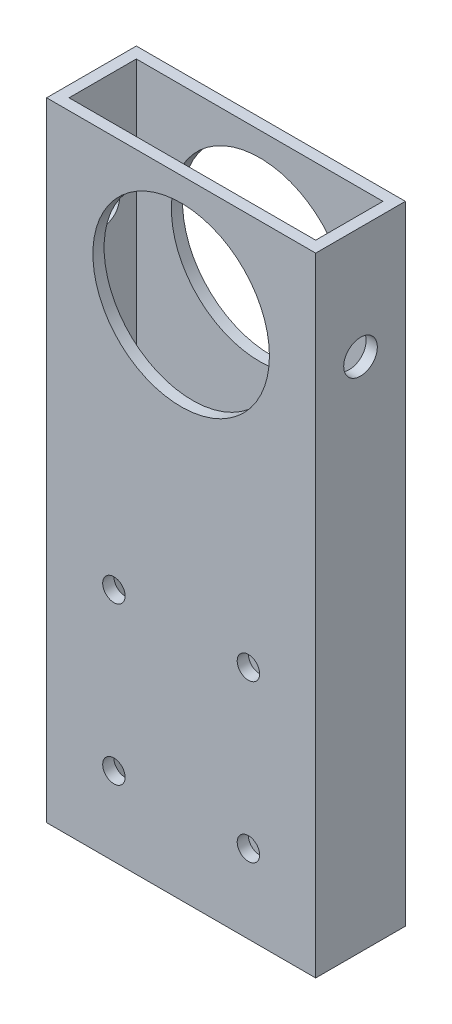
from build123d import *

# Parameters (mm, degrees)
SKETCH1_W               = 76.2
SKETCH1_H               = 25.4
SKETCH1_W_2             = 69.85
SKETCH1_H_2             = 19.05
BOSS_EXTRUDE1_DEPTH     = 177.8
SKETCH2_R               = 25
CUT_EXTRUDE1_DEPTH      = 184.601770144
CUT_EXTRUDE2_DEPTH      = 194.857086535
CUT_EXTRUDE2_DEPTH_BACK = 194.857086535
SKETCH3_R               = 4.7625
CUT_EXTRUDE3_DEPTH      = 184.601770144
CUT_EXTRUDE3_DEPTH_BACK = 184.601770144
SKETCH4_R               = 3.175


with BuildPart() as part:
    # Sketch1 → Boss-Extrude1 (new body)
    with BuildSketch(Plane(origin=(0, 0, 0), x_dir=(1, 0, 0), z_dir=(0, 1, 0))):
        Rectangle(SKETCH1_W, SKETCH1_H)
        Rectangle(SKETCH1_W_2, SKETCH1_H_2, mode=Mode.SUBTRACT)
    extrude(amount=BOSS_EXTRUDE1_DEPTH)

    # Sketch2 → Cut-Extrude1 (cut, through all)
    with BuildSketch(Plane.XY.offset(12.7)):
        with Locations((0, 146.05)):
            Circle(SKETCH2_R)
    extrude(amount=-CUT_EXTRUDE1_DEPTH, mode=Mode.SUBTRACT)

    # Sketch3 → Cut-Extrude2 (cut, two sides: drawn at the far end of the back side and taken through both)
    with BuildSketch(Plane.ZY.offset(38.1).offset(-CUT_EXTRUDE2_DEPTH_BACK)):
        with Locations((0, 146.05)):
            Circle(SKETCH3_R)
    extrude(amount=CUT_EXTRUDE2_DEPTH + CUT_EXTRUDE2_DEPTH_BACK, mode=Mode.SUBTRACT)

    # Sketch4 → Cut-Extrude3 (cut, two sides: drawn at the far end of the back side and taken through both)
    with BuildSketch(Plane.XY.offset(12.7).offset(-CUT_EXTRUDE3_DEPTH_BACK)):
        with Locations((-19.05, 66.675)):
            Circle(SKETCH4_R)
        with Locations((19.05, 66.675)):
            Circle(SKETCH4_R)
        with Locations((19.05, 22.225)):
            Circle(SKETCH4_R)
        with Locations((-19.05, 22.225)):
            Circle(SKETCH4_R)
    extrude(amount=CUT_EXTRUDE3_DEPTH + CUT_EXTRUDE3_DEPTH_BACK, mode=Mode.SUBTRACT)


solid = part.part
